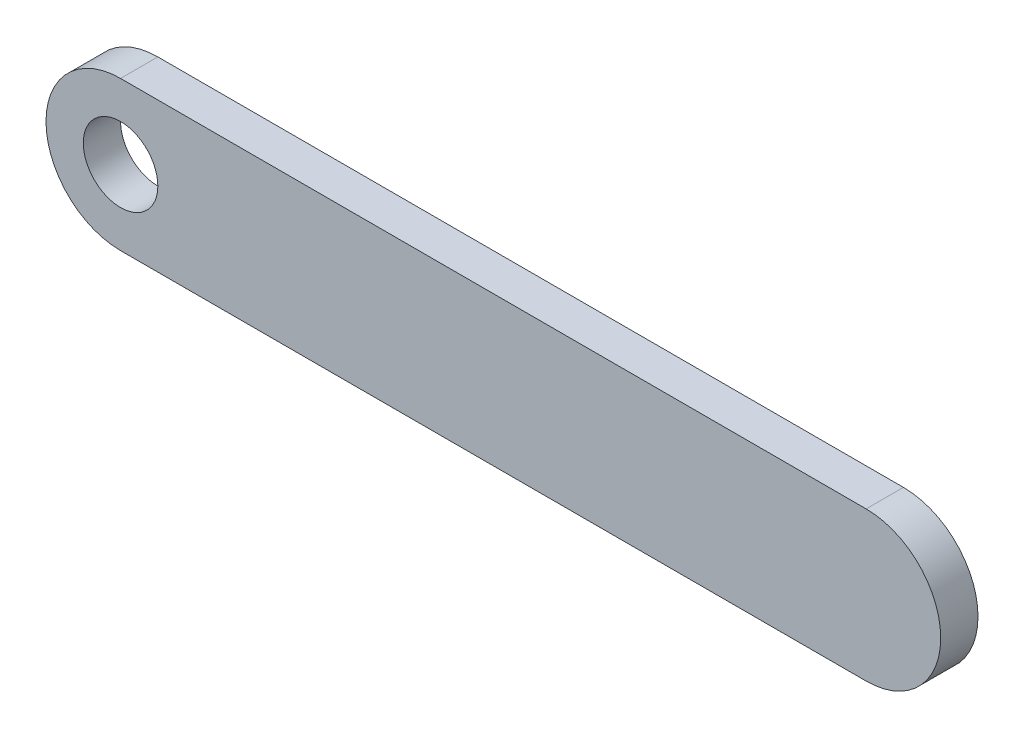
from build123d import *

# Parameters (mm, degrees)
CROQUIS1_R              = 5
SALIENTE_EXTRUIR1_DEPTH = 5


with BuildPart() as part:
    # Croquis1 → Saliente-Extruir1 (new body)
    with BuildSketch(Plane.XY):
        with BuildLine():
            Line((0, 10), (100, 10))
            ThreePointArc((100, 10), (110, 0), (100, -10))
            Line((100, -10), (0, -10))
            ThreePointArc((0, -10), (-10, 0), (0, 10))
        make_face()
        Circle(CROQUIS1_R, mode=Mode.SUBTRACT)
    extrude(amount=SALIENTE_EXTRUIR1_DEPTH)


solid = part.part
